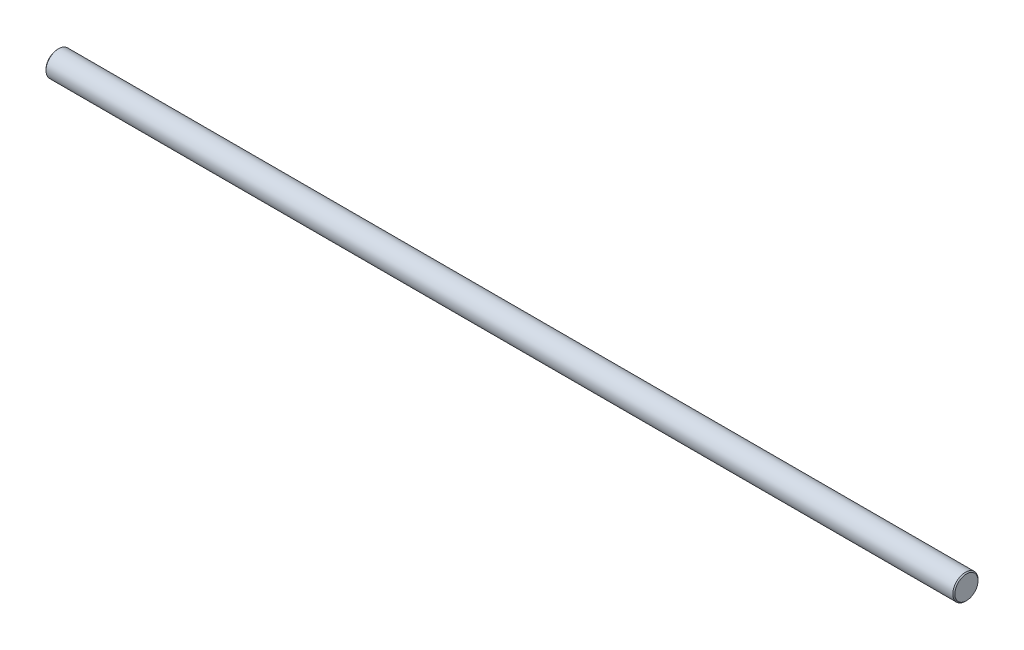
from build123d import *

# Parameters (mm, degrees)
SKETCH1_R           = 6.34365
BOSS_EXTRUDE1_DEPTH = 228.6
CHAMFER1_SIZE       = 0.508


with BuildPart() as part:
    # Sketch1 → Boss-Extrude1 (new, symmetric)
    with BuildSketch(Plane(origin=(0, 0, 0), x_dir=(0, 0, -1), z_dir=(1, 0, 0))):
        Circle(SKETCH1_R)
    extrude(amount=BOSS_EXTRUDE1_DEPTH, both=True)

    # Chamfer1
    chamfer1_edges = [part.edges().sort_by_distance(p)[0] for p in [
        (-228.6, 0, 6.34365),
        (228.6, 0, 6.34365),
    ]]
    chamfer(chamfer1_edges, length=CHAMFER1_SIZE)


solid = part.part
